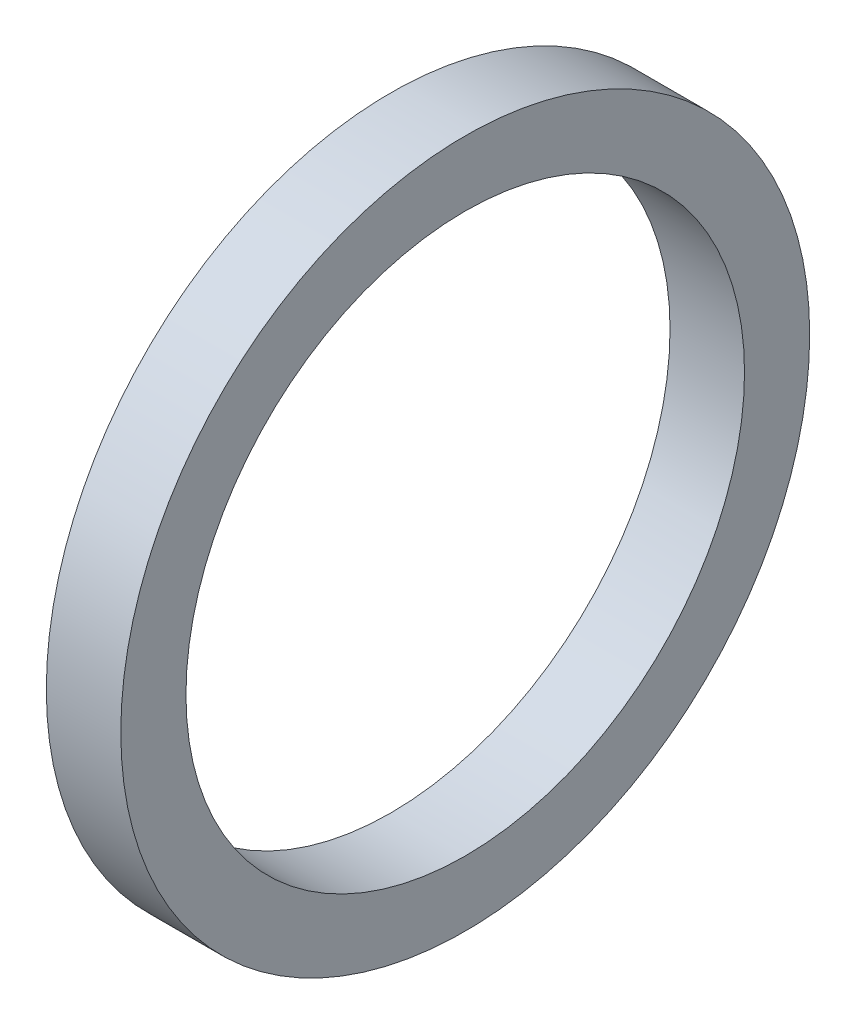
from build123d import *

# Parameters (mm, degrees)
SKETCH_1_W = 4
SKETCH_1_H = 3.5


with BuildPart() as part:
    # 草图1 → 旋转1 (revolve)
    with BuildSketch(Plane.XY, mode=Mode.PRIVATE) as revolve_1_sk:
        with Locations((2, 16.75)):
            Rectangle(SKETCH_1_W, SKETCH_1_H)
    revolve(revolve_1_sk.sketch.rotate(Axis((24.62962963, 0, 0), (-1, 0, 0)), 90), axis=Axis((24.62962963, 0, 0), (-1, 0, 0)))


solid = part.part
